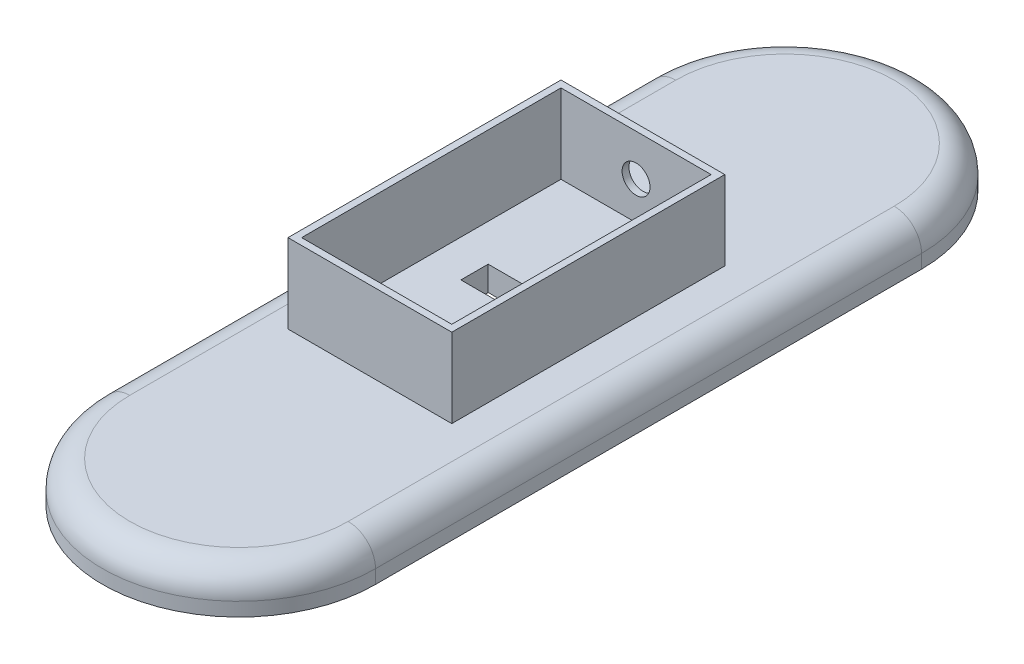
from build123d import *

# Parameters (mm, degrees)
ESQUISSE1_R                  = 50
ESQUISSE1_W                  = 100
ESQUISSE1_H                  = 200
BOSS_EXTRU_2_DEPTH           = 15
CONG_3_R                     = 10
ENL_V_MAT_EXTRU_6_DEPTH      = 6
BOSS_EXTRU_3_DEPTH           = 44
BOSS_EXTRU_3_DEPTH_BACK      = 0.5
ESQUISSE1_6_W                = 55
ESQUISSE1_6_H                = 95
ENL_V_MAT_EXTRU_7_DEPTH      = 90
ENL_V_MAT_EXTRU_7_DEPTH_BACK = 131
ESQUISSE1_10_W               = 25
ESQUISSE1_10_H               = 10
ESQUISSE6_R                  = 5.118807206
ENL_V_MAT_EXTRU_8_DEPTH      = 13


with BuildPart() as part:
    # Esquisse1 → Boss.-Extru.2 (new body)
    with BuildSketch(Plane(origin=(0, 0, 0), x_dir=(1, 0, 0), z_dir=(0, 1, 0))):
        with Locations((-0.858369099, 46.305967004)):
            Circle(ESQUISSE1_R)
        with Locations((-0.858369099, -153.694032996)):
            Circle(ESQUISSE1_R)
        with Locations((-0.858369099, -53.694032996)):
            Rectangle(ESQUISSE1_W, ESQUISSE1_H)
    extrude(amount=BOSS_EXTRU_2_DEPTH)

    # Congé3
    cong_3_edges = [part.edges().sort_by_distance(p)[0] for p in [
        (-0.858369099, 15, -96.305967004),
        (-50.858369099, 15, 53.694032996),
        (-0.858369099, 15, 203.694032996),
        (49.141630901, 15, 53.694032996),
    ]]
    fillet(cong_3_edges, radius=CONG_3_R)

    # Esquisse1<5> → Enlèv. mat.-Extru.6 (cut)
    with BuildSketch(Plane(origin=(0, 0, 0), x_dir=(1, 0, 0), z_dir=(0, 1, 0))):
        with BuildLine():
            ThreePointArc((44.141630901, 46.305967004), (-0.858369099, 91.305967004), (-45.858369099, 46.305967004))
            Line((-45.858369099, 46.305967004), (-45.858369099, -153.694032996))
            ThreePointArc((-45.858369099, -153.694032996), (-0.858369099, -198.694032996), (44.141630901, -153.694032996))
            Line((44.141630901, -153.694032996), (44.141630901, 46.305967004))
        make_face()
    extrude(amount=ENL_V_MAT_EXTRU_6_DEPTH, mode=Mode.SUBTRACT)

    # Esquisse1<6> → Boss.-Extru.3 (add, two sides: drawn at the far end of the back side and taken through both)
    with BuildSketch(Plane(origin=(0, 0, 0), x_dir=(1, 0, 0), z_dir=(0, 1, 0)).offset(-BOSS_EXTRU_3_DEPTH_BACK)):
        Polygon((27.084452796, -3.694032996), (-0.858369099, -3.694032996), (-32.915547204, -3.694032996), (-32.915547204, -103.694032996), (-0.858368676, -103.694032996), (27.084452796, -103.694032996), align=None)
        with Locations((-2.915547204, -53.694032996)):
            Rectangle(ESQUISSE1_6_W, ESQUISSE1_6_H, mode=Mode.SUBTRACT)
    extrude(amount=BOSS_EXTRU_3_DEPTH + BOSS_EXTRU_3_DEPTH_BACK)

    # Esquisse1<10> → Enlèv. mat.-Extru.7 (cut, two sides: drawn at the far end of the back side and taken through both)
    with BuildSketch(Plane(origin=(0, 0, 0), x_dir=(1, 0, 0), z_dir=(0, 1, 0)).offset(-ENL_V_MAT_EXTRU_7_DEPTH_BACK)):
        with Locations((-4.32906887, -51.451666969)):
            Rectangle(ESQUISSE1_10_W, ESQUISSE1_10_H)
    extrude(amount=ENL_V_MAT_EXTRU_7_DEPTH + ENL_V_MAT_EXTRU_7_DEPTH_BACK, mode=Mode.SUBTRACT)

    # Esquisse6 → Enlèv. mat.-Extru.8 (cut)
    with BuildSketch(Plane.XY):
        with Locations((-2.915547204, 28.813279857)):
            Circle(ESQUISSE6_R)
    extrude(amount=ENL_V_MAT_EXTRU_8_DEPTH, mode=Mode.SUBTRACT)


solid = part.part
